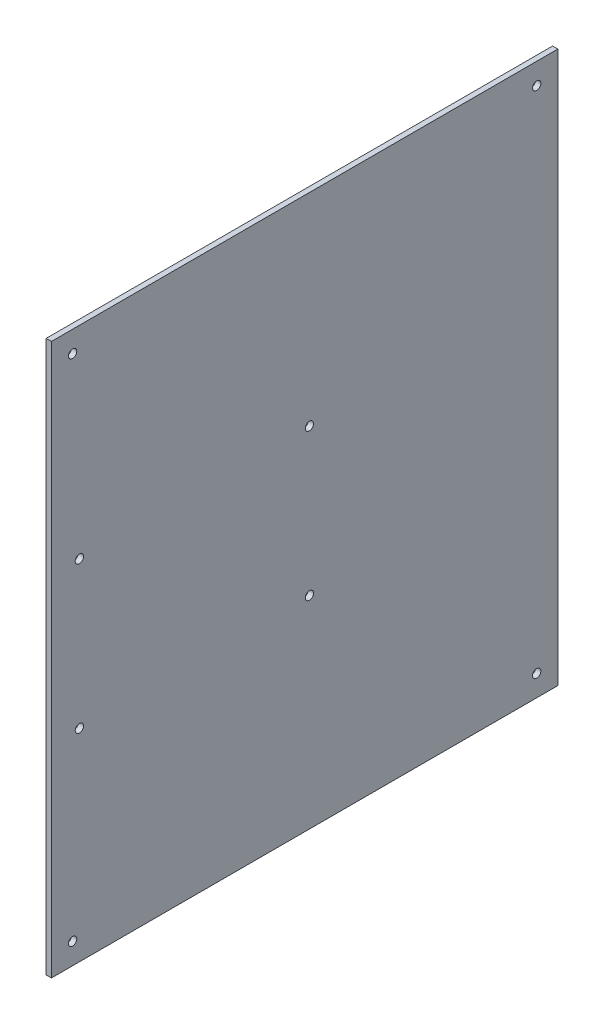
from build123d import *

# Parameters (mm, degrees)
SKETCH1_W           = 82.677
SKETCH1_H           = 151.892
SKETCH1_R           = 1.25
BOSS_EXTRUDE1_DEPTH = 1.58234


with BuildPart() as part:
    # Sketch1 → Boss-Extrude1 (new body)
    # profile 1 of 2: a face of its own
    with BuildSketch(Plane.YZ):
        with Locations((-41.3385, -75.946)):
            Rectangle(SKETCH1_W, SKETCH1_H)
        with Locations(Location((-76.327, -145.542, 0), (0, 0, 270))):
            Circle(SKETCH1_R, mode=Mode.SUBTRACT)
        with Locations(Location((-22, -77.382, 0), (0, 0, 270))):
            Circle(SKETCH1_R, mode=Mode.SUBTRACT)
        with Locations(Location((-76.327, -6.35, 0), (0, 0, 270))):
            Circle(SKETCH1_R, mode=Mode.SUBTRACT)
        with Locations(Location((-22, -8.382, 0), (0, 0, 270))):
            Circle(SKETCH1_R, mode=Mode.SUBTRACT)
    # profile 2 of 2: a face of its own
    with BuildSketch(Plane.YZ):
        with Locations((41.3385, -75.946)):
            Rectangle(SKETCH1_W, SKETCH1_H)
        with Locations(Location((76.327, -145.542, 0), (0, 0, 270))):
            Circle(SKETCH1_R, mode=Mode.SUBTRACT)
        with Locations(Location((22, -77.382, 0), (0, 0, 270))):
            Circle(SKETCH1_R, mode=Mode.SUBTRACT)
        with Locations(Location((22, -8.382, 0), (0, 0, 270))):
            Circle(SKETCH1_R, mode=Mode.SUBTRACT)
        with Locations(Location((76.327, -6.35, 0), (0, 0, 270))):
            Circle(SKETCH1_R, mode=Mode.SUBTRACT)
    extrude(amount=BOSS_EXTRUDE1_DEPTH)


solid = part.part
